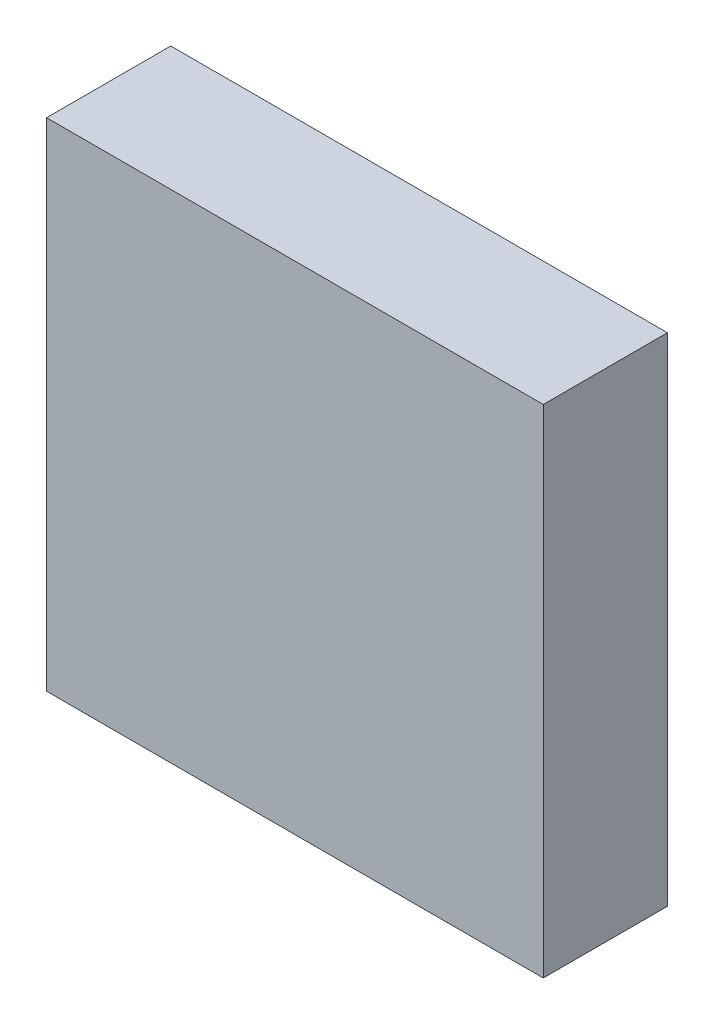
from build123d import *

# Parameters (mm, degrees)
SKETCH1_W           = 12.7
SKETCH1_H           = 12.7
BOSS_EXTRUDE1_DEPTH = 3.175


with BuildPart() as part:
    # Sketch1 → Boss-Extrude1 (new body)
    with BuildSketch(Plane.XY):
        with Locations((0.126846992, 4.244812194)):
            Rectangle(SKETCH1_W, SKETCH1_H)
    extrude(amount=BOSS_EXTRUDE1_DEPTH)


solid = part.part
